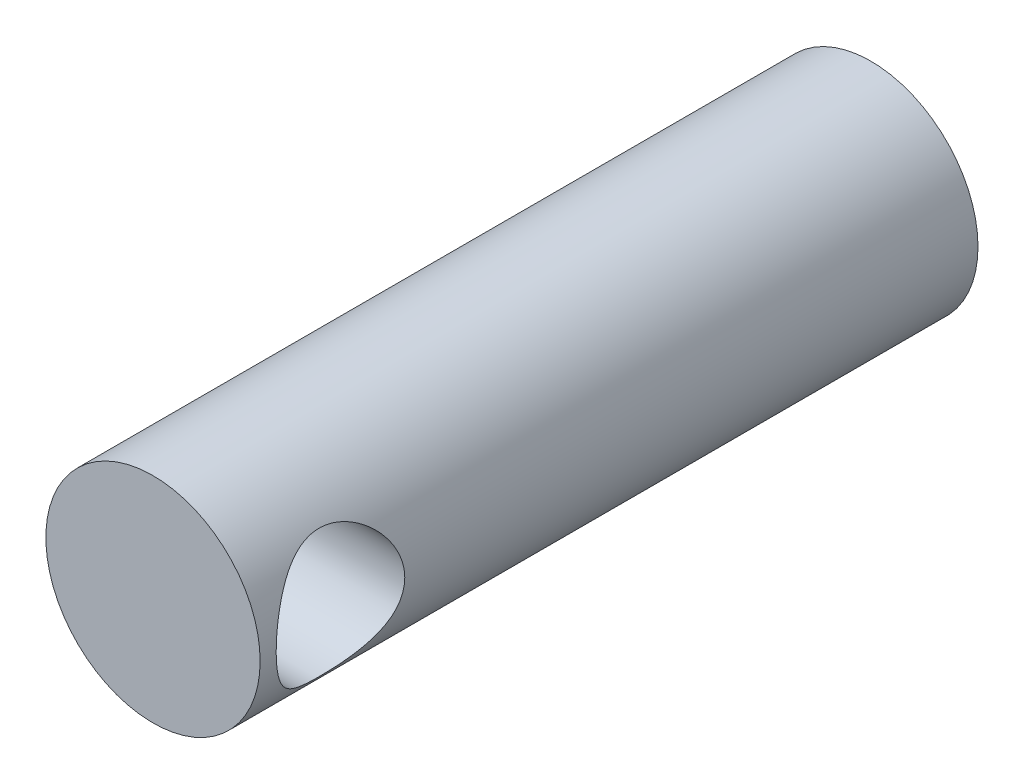
from build123d import *

# Parameters (mm, degrees)
ESBO_O1_R                = 10
RESSALTO_EXTRUS_O1_DEPTH = 67
ESBO_O3_R                = 6
CORTE_EXTRUS_O1_DEPTH    = 10


with BuildPart() as part:
    # Esboço1 → Ressalto-extrusão1 (new body)
    with BuildSketch(Plane.XY):
        Circle(ESBO_O1_R)
    extrude(amount=RESSALTO_EXTRUS_O1_DEPTH)

    # Esboço3 → Corte-extrusão1 (cut, symmetric)
    with BuildSketch(Plane(origin=(0, 0, 0), x_dir=(0, 0, -1), z_dir=(1, 0, 0))):
        with Locations((-59.5, 0)):
            Circle(ESBO_O3_R)
    extrude(amount=CORTE_EXTRUS_O1_DEPTH, both=True, mode=Mode.SUBTRACT)


solid = part.part
